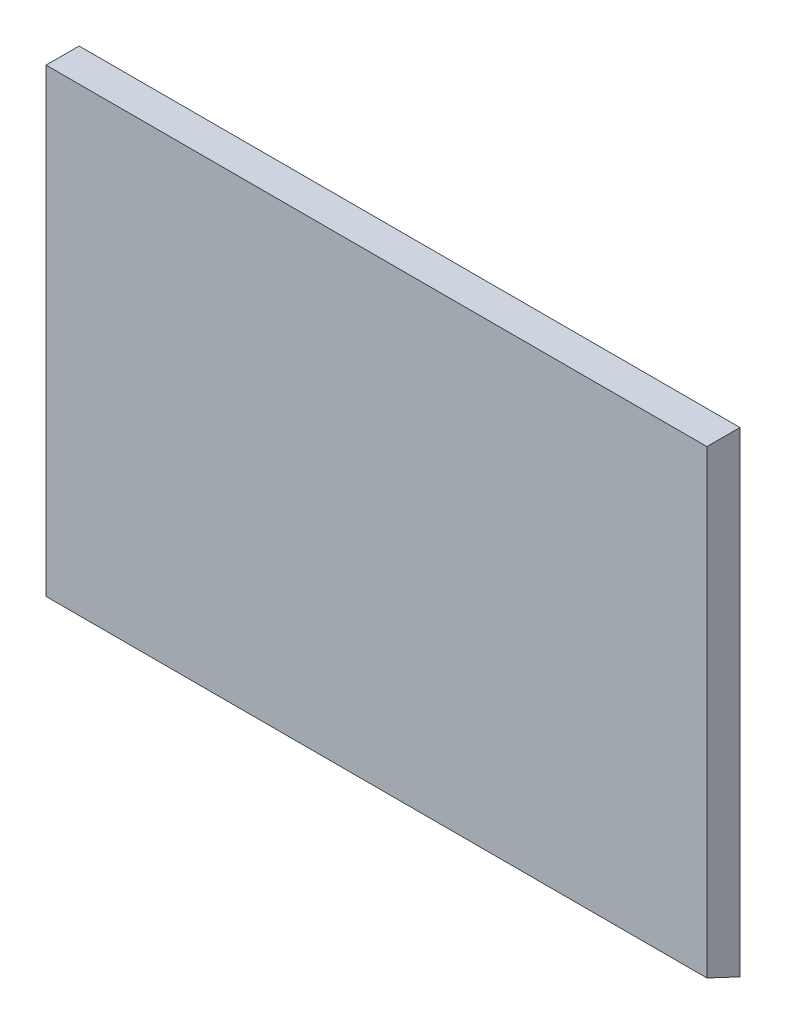
from build123d import *

# Parameters (mm, degrees)
SKETCH1_W           = 14
SKETCH1_H           = 0.7
BOSS_EXTRUDE1_DEPTH = 9.75
BOSS_EXTRUDE3_DEPTH = 14


with BuildPart() as part:
    # Sketch1 → Boss-Extrude1 (new body)
    with BuildSketch(Plane(origin=(0, 0, 0), x_dir=(1, 0, 0), z_dir=(0, 1, 0))):
        with Locations((0.5, -0.15)):
            Rectangle(SKETCH1_W, SKETCH1_H)
    extrude(amount=BOSS_EXTRUDE1_DEPTH)

    # Sketch4 → Boss-Extrude3 (add)
    with BuildSketch(Plane(origin=(7.5, 0, 0), x_dir=(0, 0, -1), z_dir=(1, 0, 0))):
        Polygon((-0.5, 0), (0.2, 0), (0.2, -0.329523645), align=None)
    extrude(amount=-BOSS_EXTRUDE3_DEPTH)


solid = part.part
